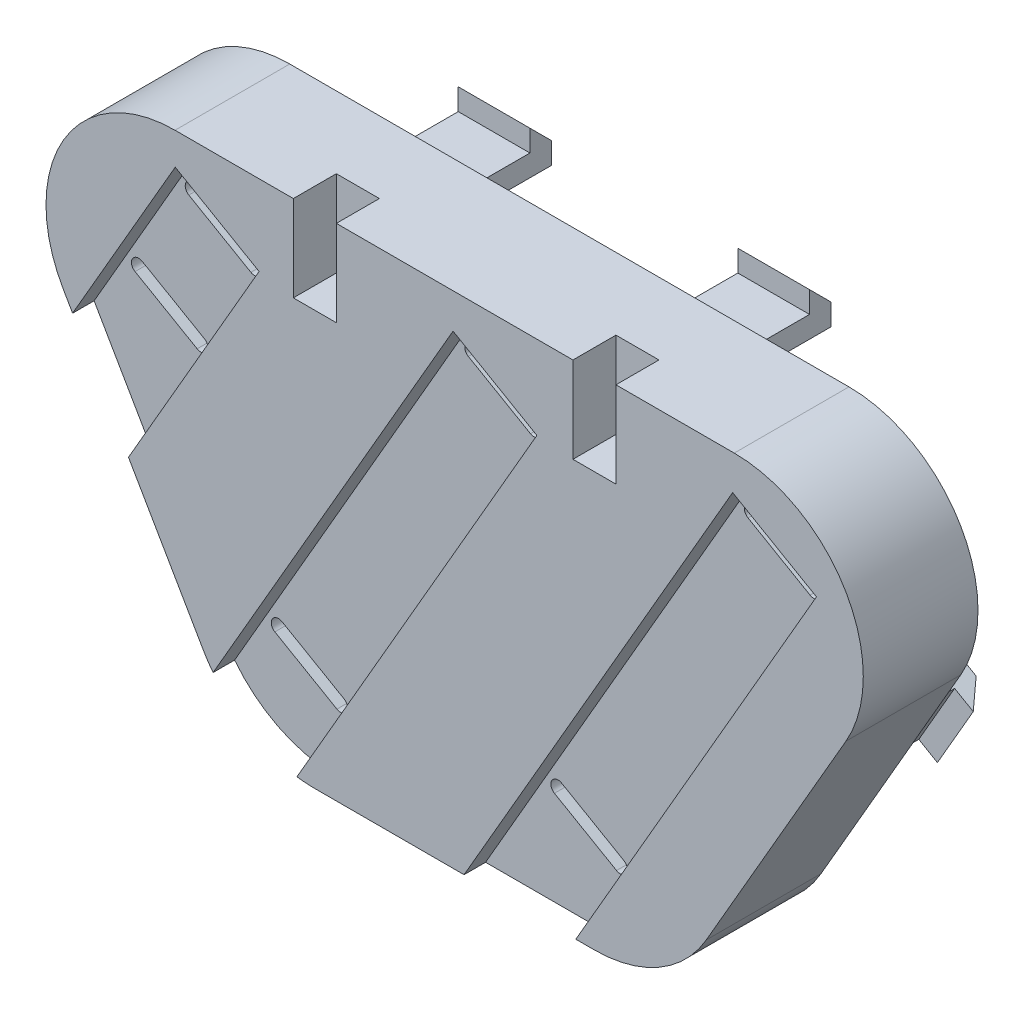
from build123d import *

# Parameters (mm, degrees)
SKETCH1_R           = 7.5
BOSS_EXTRUDE1_DEPTH = 5
BOSS_EXTRUDE2_DEPTH = 1.5
BOSS_EXTRUDE3_DEPTH = 1.5
SKETCH4_W           = 5
SKETCH4_H           = 3
BOSS_EXTRUDE4_DEPTH = 6
CUT_EXTRUDE1_REACH  = 58.12
SKETCH5_W           = 1.5
SKETCH5_H           = 4.5
CUT_EXTRUDE2_REACH  = 50.936
SKETCH7_W           = 4.5
SKETCH7_H           = 1.5
CUT_EXTRUDE3_REACH  = 43.172
SKETCH8_W           = 4.5
SKETCH8_H           = 1.5
SKETCH9_W           = 3
SKETCH9_H           = 6
CUT_EXTRUDE4_DEPTH  = 3


with BuildPart() as part:
    # Sketch1 → Boss-Extrude1 (new body)
    with BuildSketch(Plane.XY):
        with BuildLine():
            Line((7.794228634, -4.5), (-1.955771366, -21.387495374))
            ThreePointArc((-1.955771366, -21.387495374), (-5.25, -24.681724008), (-9.75, -25.887495374))
            Line((-9.75, -25.887495374), (-29.25, -25.887495374))
            ThreePointArc((-29.25, -25.887495374), (-33.75, -24.681724008), (-37.044228634, -21.387495374))
            Line((-37.044228634, -21.387495374), (-46.794228634, -4.5))
            ThreePointArc((-46.794228634, -4.5), (-46.794228634, 4.5), (-39, 9))
            Line((-39, 9), (0, 9))
            ThreePointArc((0, 9), (7.794228634, 4.5), (7.794228634, -4.5))
        make_face()
        with Locations((-29.25, -16.887495374)):
            Circle(SKETCH1_R, mode=Mode.SUBTRACT)
        with Locations((-19.5, 0)):
            Circle(SKETCH1_R, mode=Mode.SUBTRACT)
        Circle(SKETCH1_R, mode=Mode.SUBTRACT)
        with Locations((-9.75, -16.887495374)):
            Circle(SKETCH1_R, mode=Mode.SUBTRACT)
        with Locations((-39, 0)):
            Circle(SKETCH1_R, mode=Mode.SUBTRACT)
    extrude(amount=BOSS_EXTRUDE1_DEPTH)

    # Sketch2 → Boss-Extrude2 (add)
    with BuildSketch(Plane.XY.offset(5)):
        with BuildLine():
            ThreePointArc((-9.75, -25.887495374), (-5.25, -24.681724008), (-1.955771366, -21.387495374))
            Line((-1.955771366, -21.387495374), (7.794228634, -4.5))
            ThreePointArc((7.794228634, -4.5), (7.794228634, 4.5), (0, 9))
            Line((0, 9), (-39, 9))
            ThreePointArc((-39, 9), (-46.794228634, 4.5), (-46.794228634, -4.5))
            Line((-46.794228634, -4.5), (-37.044228634, -21.387495374))
            ThreePointArc((-37.044228634, -21.387495374), (-33.75, -24.681724008), (-29.25, -25.887495374))
            Line((-29.25, -25.887495374), (-9.75, -25.887495374))
        make_face()
        with BuildLine():
            Line((-29.209936491, -21.81810334), (-33.540063509, -19.31810334))
            ThreePointArc((-33.540063509, -19.31810334), (-33.723076211, -18.635090638), (-33.040063509, -18.452077936))
            Line((-33.040063509, -18.452077936), (-28.709936491, -20.952077936))
            ThreePointArc((-28.709936491, -20.952077936), (-28.526923789, -21.635090638), (-29.209936491, -21.81810334))
        make_face(mode=Mode.SUBTRACT)
        with BuildLine():
            Line((-9.709936491, -21.81810334), (-14.040063509, -19.31810334))
            ThreePointArc((-14.040063509, -19.31810334), (-14.223076211, -18.635090638), (-13.540063509, -18.452077936))
            Line((-13.540063509, -18.452077936), (-9.209936491, -20.952077936))
            ThreePointArc((-9.209936491, -20.952077936), (-9.026923789, -21.635090638), (-9.709936491, -21.81810334))
        make_face(mode=Mode.SUBTRACT)
        with BuildLine():
            Line((-35.209936491, 1.564582562), (-39.540063509, 4.064582562))
            ThreePointArc((-39.540063509, 4.064582562), (-39.723076211, 4.747595264), (-39.040063509, 4.930607966))
            Line((-39.040063509, 4.930607966), (-34.709936491, 2.430607966))
            ThreePointArc((-34.709936491, 2.430607966), (-34.526923789, 1.747595264), (-35.209936491, 1.564582562))
        make_face(mode=Mode.SUBTRACT)
        with BuildLine():
            ThreePointArc((-38.459936491, -4.064582562), (-38.276923789, -4.747595264), (-38.959936491, -4.930607966))
            Line((-38.959936491, -4.930607966), (-43.290063509, -2.430607966))
            ThreePointArc((-43.290063509, -2.430607966), (-43.473076211, -1.747595264), (-42.790063509, -1.564582562))
            Line((-42.790063509, -1.564582562), (-38.459936491, -4.064582562))
        make_face(mode=Mode.SUBTRACT)
        with BuildLine():
            Line((-15.709936491, 1.564582562), (-20.040063509, 4.064582562))
            ThreePointArc((-20.040063509, 4.064582562), (-20.223076211, 4.747595264), (-19.540063509, 4.930607966))
            Line((-19.540063509, 4.930607966), (-15.209936491, 2.430607966))
            ThreePointArc((-15.209936491, 2.430607966), (-15.026923789, 1.747595264), (-15.709936491, 1.564582562))
        make_face(mode=Mode.SUBTRACT)
        with BuildLine():
            Line((3.790063509, 1.564582562), (-0.540063509, 4.064582562))
            ThreePointArc((-0.540063509, 4.064582562), (-0.723076211, 4.747595264), (-0.040063509, 4.930607966))
            Line((-0.040063509, 4.930607966), (4.290063509, 2.430607966))
            ThreePointArc((4.290063509, 2.430607966), (4.473076211, 1.747595264), (3.790063509, 1.564582562))
        make_face(mode=Mode.SUBTRACT)
    extrude(amount=BOSS_EXTRUDE2_DEPTH)

    # Sketch3 → Boss-Extrude3 (add)
    with BuildSketch(Plane.XY.offset(6.5)):
        with BuildLine():
            ThreePointArc((-39, 9), (-46.794228634, 4.5), (-46.794228634, -4.5))
            Line((-46.794228634, -4.5), (-46.144709581, -5.625))
            Line((-46.144709581, -5.625), (-38.985335738, 6.775399247))
            Line((-38.985335738, 6.775399247), (-33.139664262, 3.400399247))
            Line((-33.139664262, 3.400399247), (-42.247595264, -12.375))
            Line((-42.247595264, -12.375), (-37.044228634, -21.387495374))
            ThreePointArc((-37.044228634, -21.387495374), (-36.712405778, -21.918648323), (-36.344447387, -22.425438699))
            Line((-36.344447387, -22.425438699), (-34.985335738, -20.07138827))
            Line((-34.985335738, -20.07138827), (-19.610335738, 6.558892896))
            Line((-19.610335738, 6.558892896), (-13.764664262, 3.183892896))
            Line((-13.764664262, 3.183892896), (-29.139664262, -23.44638827))
            Line((-29.139664262, -23.44638827), (-30.498775911, -25.800438699))
            ThreePointArc((-30.498775911, -25.800438699), (-29.875903375, -25.865704826), (-29.25, -25.887495374))
            Line((-29.25, -25.887495374), (-18.84326674, -25.887495374))
            Line((-18.84326674, -25.887495374), (-15.485335738, -20.07138827))
            Line((-15.485335738, -20.07138827), (-0.110335738, 6.558892896))
            Line((-0.110335738, 6.558892896), (5.735335738, 3.183892896))
            Line((5.735335738, 3.183892896), (-9.639664262, -23.44638827))
            Line((-9.639664262, -23.44638827), (-11.049038106, -25.887495374))
            Line((-11.049038106, -25.887495374), (-9.75, -25.887495374))
            ThreePointArc((-9.75, -25.887495374), (-5.25, -24.681724008), (-1.955771366, -21.387495374))
            Line((-1.955771366, -21.387495374), (7.794228634, -4.5))
            ThreePointArc((7.794228634, -4.5), (7.794228634, 4.5), (0, 9))
            Line((0, 9), (-39, 9))
        make_face()
    extrude(amount=BOSS_EXTRUDE3_DEPTH)

    # Sketch4 → Boss-Extrude4 (add)
    with BuildSketch(Plane(origin=(0, 0, 0), x_dir=(-1, 0, 0), z_dir=(0, 0, -1))):
        with Locations((19.5, -24.387495374)):
            Rectangle(SKETCH4_W, SKETCH4_H)
        with Locations((29.25, 7.5)):
            Rectangle(SKETCH4_W, SKETCH4_H)
        with Locations((9.75, 7.5)):
            Rectangle(SKETCH4_W, SKETCH4_H)
        Polygon((40.669228634, -15.108811196), (43.169228634, -10.778684177), (40.571152423, -9.278684177), (38.071152423, -13.608811196), align=None)
        Polygon((-4.169228634, -10.778684177), (-1.669228634, -15.108811196), (0.928847577, -13.608811196), (-1.571152423, -9.278684177), align=None)
    extrude(amount=BOSS_EXTRUDE4_DEPTH)

    # Sketch5 → Cut-Extrude1 (cut, up to next)
    with BuildSketch(Plane(origin=(-6.125, 10.608811196, 0), x_dir=(0.8660254037844386, 0.5000000000000001, 0), z_dir=(-0.5000000000000001, 0.8660254037844386, 0)), mode=Mode.PRIVATE) as cut_extrude1_sk1:
        with Locations((-42.024990748, 2.25)):
            Rectangle(SKETCH5_W, SKETCH5_H)
    cut_extrude1_tool1 = extrude(cut_extrude1_sk1.sketch, amount=-CUT_EXTRUDE1_REACH, mode=Mode.PRIVATE) & part.part
    # Sketch5 → Cut-Extrude1 (cut, up to next)
    with BuildSketch(Plane(origin=(-6.125, 10.608811196, 0), x_dir=(0.8660254037844386, 0.5000000000000001, 0), z_dir=(-0.5000000000000001, 0.8660254037844386, 0)), mode=Mode.PRIVATE) as cut_extrude1_sk2:
        Polygon((-42.774990748, 6), (-42.774990748, 4.5), (-41.274990748, 6), align=None)
    cut_extrude1_tool2 = extrude(cut_extrude1_sk2.sketch, amount=-CUT_EXTRUDE1_REACH, mode=Mode.PRIVATE) & part.part
    cut_extrude1_1 = cut_extrude1_tool1.solids().sort_by_distance((-42.51971, -10.403684, -2.25))[0]
    add(cut_extrude1_1, mode=Mode.SUBTRACT)
    cut_extrude1_2 = cut_extrude1_tool2.solids().sort_by_distance((-42.736216, -10.528684, -5.5))[0]
    add(cut_extrude1_2, mode=Mode.SUBTRACT)
    cut_extrude1 = cut_extrude1_1 + cut_extrude1_2  # Cut-Extrude1 as one shape, for the pattern or mirror that repeats it

    # Sketch7 → Cut-Extrude2 (cut, up to next)
    with BuildSketch(Plane.ZY.offset(31.75), mode=Mode.PRIVATE) as cut_extrude2_sk1:
        with Locations((-2.25, 8.25)):
            Rectangle(SKETCH7_W, SKETCH7_H)
    cut_extrude2_tool1 = extrude(cut_extrude2_sk1.sketch, amount=-CUT_EXTRUDE2_REACH, mode=Mode.PRIVATE) & part.part
    # Sketch7 → Cut-Extrude2 (cut, up to next)
    with BuildSketch(Plane.ZY.offset(31.75), mode=Mode.PRIVATE) as cut_extrude2_sk2:
        Polygon((-6, 7.5), (-4.5, 9), (-6, 9), align=None)
    cut_extrude2_tool2 = extrude(cut_extrude2_sk2.sketch, amount=-CUT_EXTRUDE2_REACH, mode=Mode.PRIVATE) & part.part
    cut_extrude2_1 = cut_extrude2_tool1.solids().sort_by_distance((-31.75, 8.25, -2.25))[0]
    add(cut_extrude2_1, mode=Mode.SUBTRACT)
    cut_extrude2_2 = cut_extrude2_tool2.solids().sort_by_distance((-31.75, 8.5, -5.5))[0]
    add(cut_extrude2_2, mode=Mode.SUBTRACT)
    cut_extrude2 = cut_extrude2_1 + cut_extrude2_2  # Cut-Extrude2 as one shape, for the pattern or mirror that repeats it

    # Mirror1: Cut-Extrude1, Cut-Extrude2 across plane
    add(cut_extrude1.mirror(Plane(origin=(-19.5, 0, 0), x_dir=(0, 0, 1), z_dir=(1, 0, 0))), mode=Mode.SUBTRACT)
    add(cut_extrude2.mirror(Plane(origin=(-19.5, 0, 0), x_dir=(0, 0, 1), z_dir=(1, 0, 0))), mode=Mode.SUBTRACT)

    # Sketch8 → Cut-Extrude3 (cut, up to next)
    with BuildSketch(Plane.ZY.offset(22), mode=Mode.PRIVATE) as cut_extrude3_sk1:
        Polygon((-6, -25.887495374), (-4.5, -25.887495374), (-6, -24.387495374), align=None)
    cut_extrude3_tool1 = extrude(cut_extrude3_sk1.sketch, amount=-CUT_EXTRUDE3_REACH, mode=Mode.PRIVATE) & part.part
    # Sketch8 → Cut-Extrude3 (cut, up to next)
    with BuildSketch(Plane.ZY.offset(22), mode=Mode.PRIVATE) as cut_extrude3_sk2:
        with Locations((-2.25, -25.137495374)):
            Rectangle(SKETCH8_W, SKETCH8_H)
    cut_extrude3_tool2 = extrude(cut_extrude3_sk2.sketch, amount=-CUT_EXTRUDE3_REACH, mode=Mode.PRIVATE) & part.part
    add(cut_extrude3_tool1.solids().sort_by_distance((-22, -25.387495, -5.5))[0], mode=Mode.SUBTRACT)
    add(cut_extrude3_tool2.solids().sort_by_distance((-22, -25.137495, -2.25))[0], mode=Mode.SUBTRACT)

    # Sketch9 → Cut-Extrude4 (cut)
    with BuildSketch(Plane.XY.offset(8)):
        with Locations((-29.25, 6)):
            Rectangle(SKETCH9_W, SKETCH9_H)
        with Locations((-9.75, 6)):
            Rectangle(SKETCH9_W, SKETCH9_H)
    extrude(amount=-CUT_EXTRUDE4_DEPTH, mode=Mode.SUBTRACT)


solid = part.part
